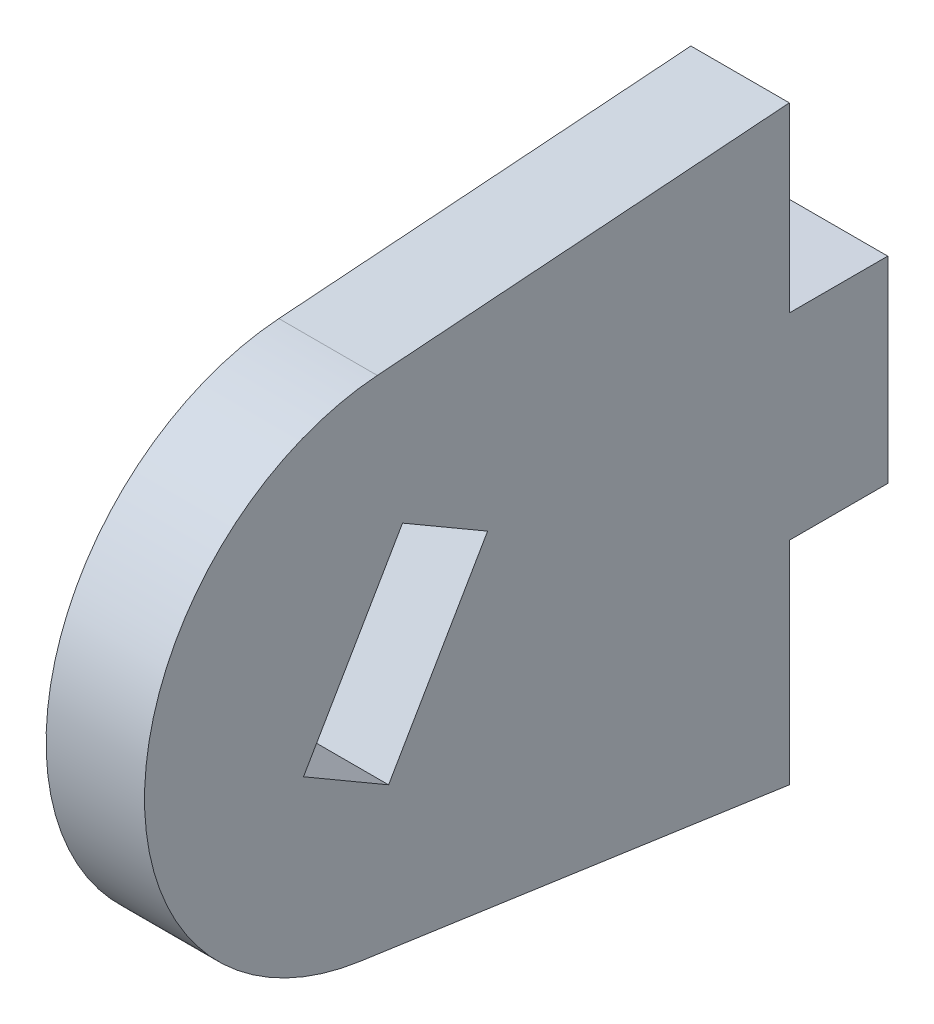
from build123d import *

# Parameters (mm, degrees)
BOSS_EXTRUDE1_DEPTH = 2.5


with BuildPart() as part:
    # Sketch1 → Boss-Extrude1 (new, symmetric)
    with BuildSketch(Plane.YZ):
        with BuildLine():
            Line((-15.757717512, 0), (-5, 0))
            Line((-5, 0), (-5, -5))
            Line((-5, -5), (5, -5))
            Line((5, -5), (5, 0))
            Line((5, 0), (14.242282488, 0))
            Line((14.242282488, 0), (12.716235334, 20.927285791))
            ThreePointArc((12.716235334, 20.927285791), (0.446501859, 32.742179409), (-12.620138577, 21.815103933))
            Line((-12.620138577, 21.815103933), (-15.757717512, 0))
        make_face()
        Polygon((5.57894904, 19.645983596), (-3.064156301, 24.675569074), (-5.57894904, 20.354016404), (3.064156301, 15.324430926), align=None, mode=Mode.SUBTRACT)
    extrude(amount=BOSS_EXTRUDE1_DEPTH, both=True)


solid = part.part
